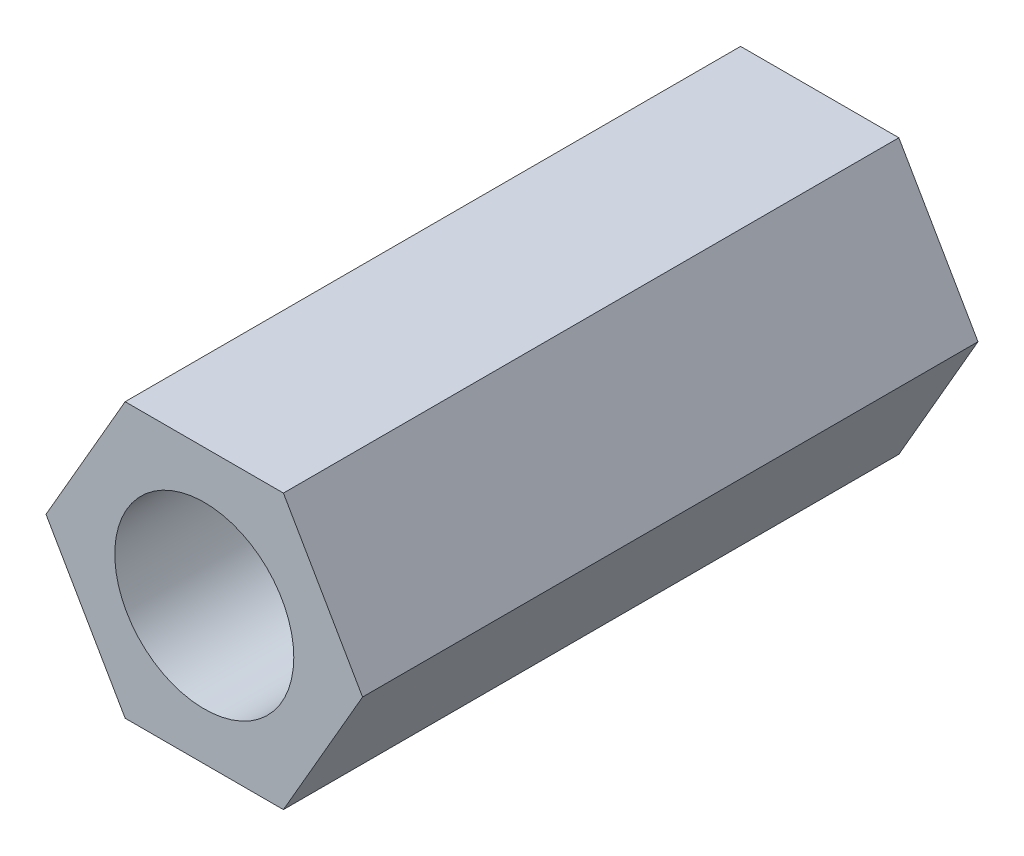
from build123d import *

# Parameters (mm, degrees)
SKETCH_1_R      = 1.6
EXTRUDE_1_DEPTH = 11


with BuildPart() as part:
    # 草图1 → 凸台-拉伸1 (new body)
    with BuildSketch(Plane.XY):
        Polygon((2.829016319, 0), (1.41450816, 2.45), (-1.41450816, 2.45), (-2.829016319, 0), (-1.41450816, -2.45), (1.41450816, -2.45), align=None)
        Circle(SKETCH_1_R, mode=Mode.SUBTRACT)
    extrude(amount=EXTRUDE_1_DEPTH)


solid = part.part
